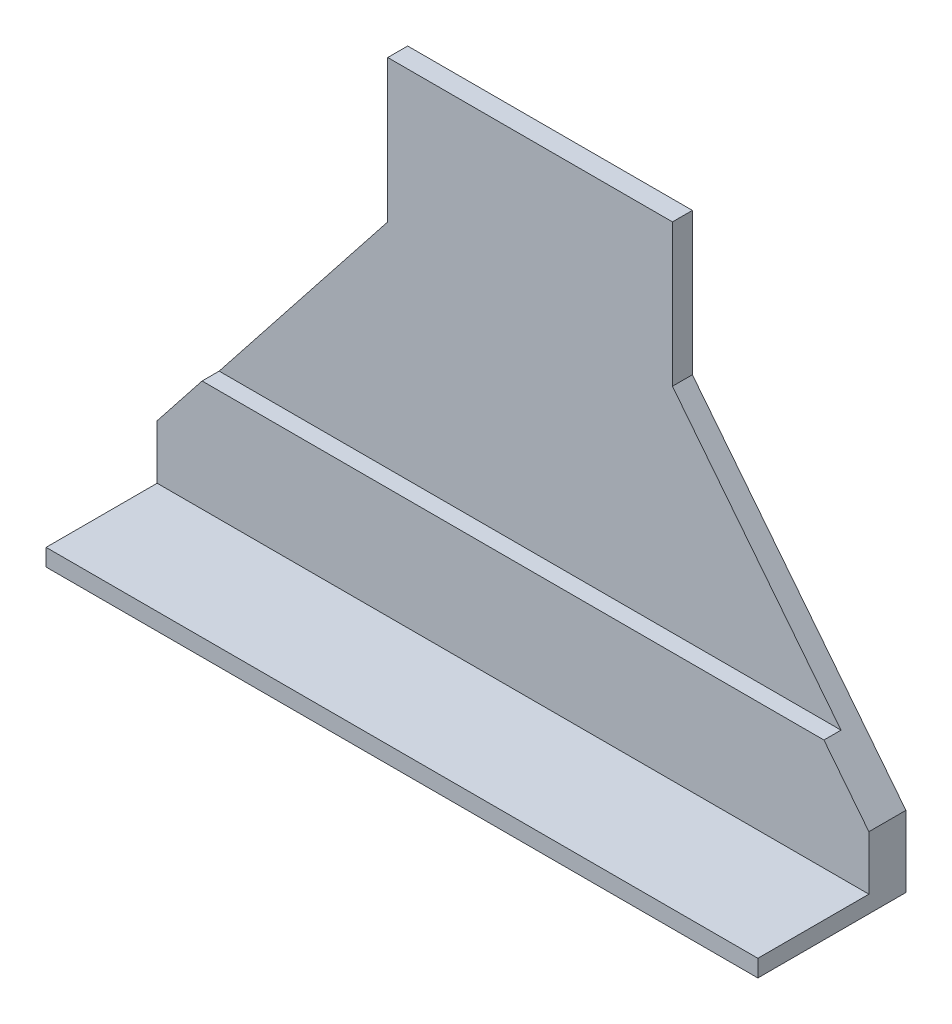
from build123d import *

# Parameters (mm, degrees)
EXTRUDE_1_DEPTH = 14
EXTRUDE_2_DEPTH = 12
SKETCH_8_W      = 500
SKETCH_8_H      = 12
EXTRUDE_5_DEPTH = 78


with BuildPart() as part:
    # 草图1 → 凸台-拉伸1 (new body)
    with BuildSketch(Plane.XY):
        Polygon((0, 0), (250, 0), (250, 50), (100, 240), (100, 340), (0, 340), (-100, 340), (-100, 240), (-250, 50), (-250, 0), align=None)
    extrude(amount=EXTRUDE_1_DEPTH)

    # 草图6 → 凸台-拉伸2 (add)
    with BuildSketch(Plane.XY.offset(14)):
        Polygon((218.421052632, 90), (-218.421052632, 90), (-250, 50), (-250, 0), (250, 0), (250, 50), align=None)
    extrude(amount=EXTRUDE_2_DEPTH)

    # 草图8 → 凸台-拉伸5 (add)
    with BuildSketch(Plane.XY.offset(26)):
        with Locations((0, 6)):
            Rectangle(SKETCH_8_W, SKETCH_8_H)
    extrude(amount=EXTRUDE_5_DEPTH)


solid = part.part
